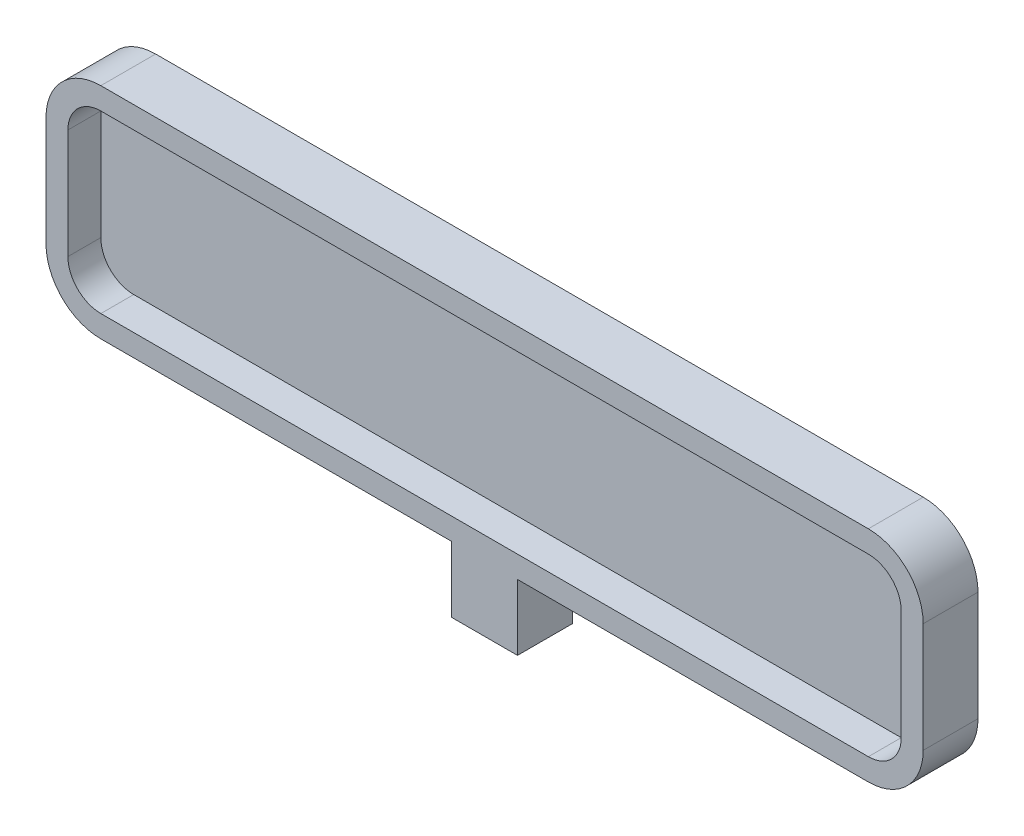
from build123d import *

# Parameters (mm, degrees)
SKETCH1_W           = 80
SKETCH1_H           = 20
BOSS_EXTRUDE1_DEPTH = 5
FILLET1_R           = 5
SHELL1_T            = -2
SKETCH2_W           = 6
SKETCH2_H           = 5
BOSS_EXTRUDE2_DEPTH = 6
SKETCH3_R           = 1.425
CUT_EXTRUDE1_DEPTH  = 4


with BuildPart() as part:
    # Sketch1 → Boss-Extrude1 (new body)
    with BuildSketch(Plane.XY):
        Rectangle(SKETCH1_W, SKETCH1_H)
    extrude(amount=BOSS_EXTRUDE1_DEPTH)

    # Fillet1
    fillet1_edges = [part.edges().sort_by_distance(p)[0] for p in [
        (-40, 10, 2.5),
        (40, 10, 2.5),
        (40, -10, 2.5),
        (-40, -10, 2.5),
    ]]
    fillet(fillet1_edges, radius=FILLET1_R)

    # Shell1
    shell1_openings = [part.faces().sort_by_distance(p)[0] for p in [
        (0, 0, 5),
    ]]
    offset(amount=SHELL1_T, openings=shell1_openings, kind=Kind.INTERSECTION)

    # Sketch2 → Boss-Extrude2 (add)
    with BuildSketch(Plane.XZ.offset(10)):
        with Locations((0, 2.5)):
            Rectangle(SKETCH2_W, SKETCH2_H)
    extrude(amount=BOSS_EXTRUDE2_DEPTH)

    # Sketch3 → Cut-Extrude1 (cut)
    with BuildSketch(Plane.XZ.offset(16)):
        with Locations(Location((0, 2.5, 0), (0, 0, 270))):
            Circle(SKETCH3_R)
    extrude(amount=-CUT_EXTRUDE1_DEPTH, mode=Mode.SUBTRACT)


solid = part.part
